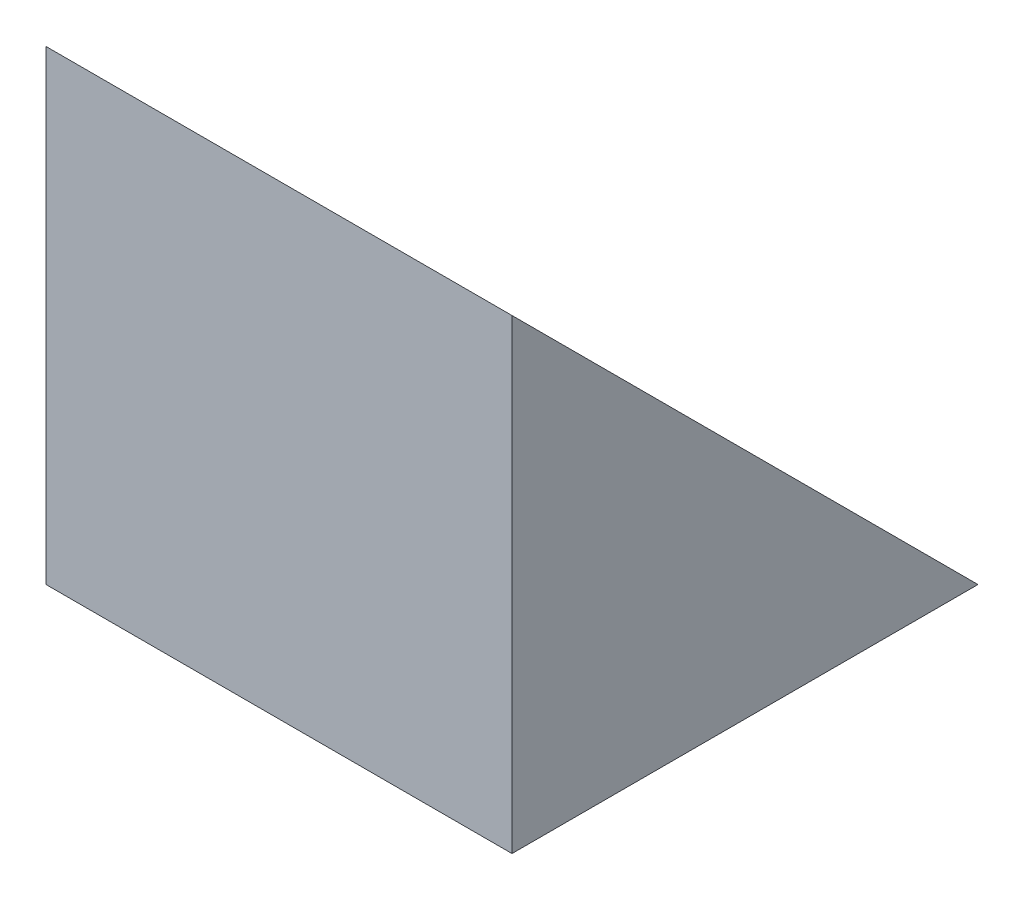
from build123d import *

# Parameters (mm, degrees)
BOSS_EXTRUDE1_DEPTH = 40


with BuildPart() as part:
    # Sketch1 → Boss-Extrude1 (new body)
    with BuildSketch(Plane(origin=(0, 0, 0), x_dir=(0, 0, -1), z_dir=(1, 0, 0))):
        Polygon((0, 0), (-40, 0), (-40, 40), align=None)
    extrude(amount=BOSS_EXTRUDE1_DEPTH)


solid = part.part
